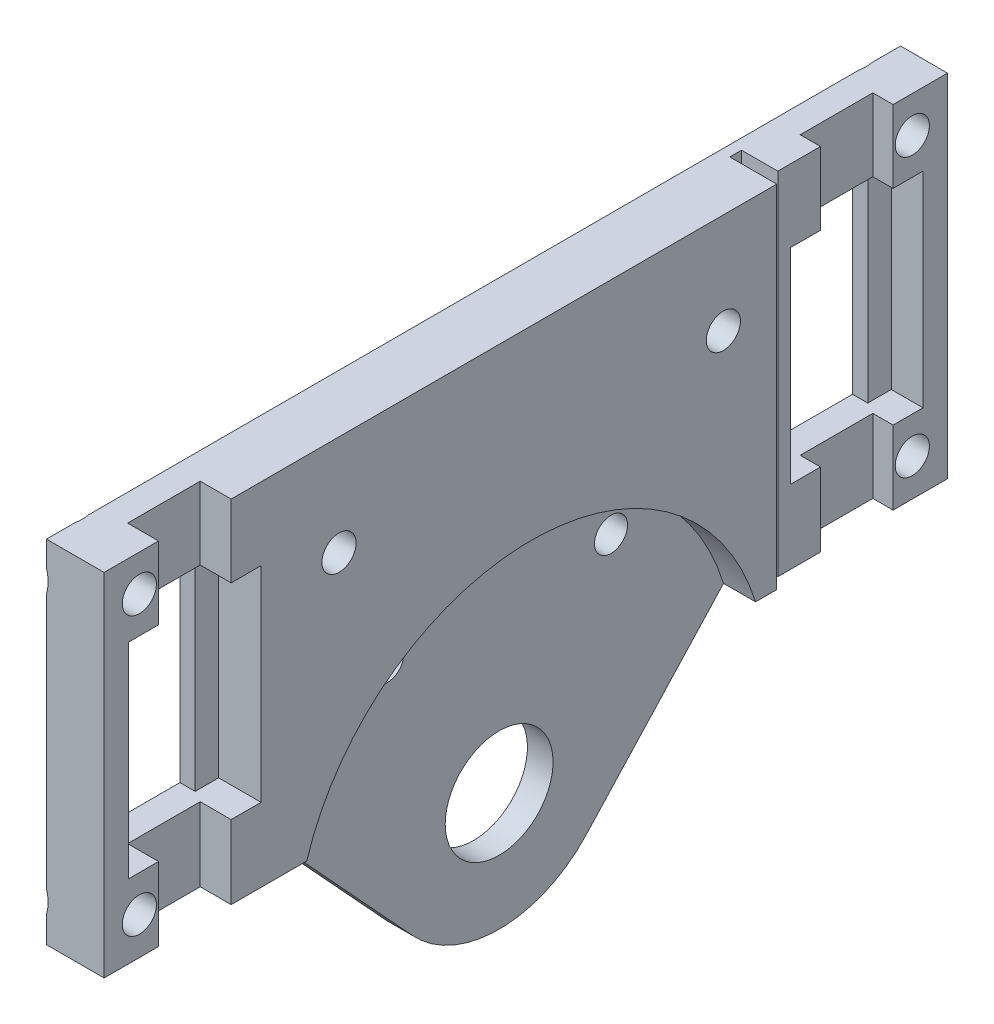
from build123d import *

# Parameters (mm, degrees)
ESQUISSE2_W                                       = 80
ESQUISSE2_H                                       = 85
PLAQUE_DEPTH                                      = 5.4
ESQUISSE15_R                                      = 22
D_GAGEMENT_ROUE_DEPTH                             = 81.678373806
D_COUPE_INF_RIEURE_DEPTH                          = 81.803217758
ESQUISSE14_R                                      = 11.05
ESQUISSE14_R_2                                    = 5.05
RENFORT_ROULEMENT_DEPTH                           = 2.4
D_COUPE_SUP_RIEURE_DEPTH                          = 81.803217758
D_GAGEMENT_AXE_6_DEPTH                            = 75.400336021
D_GAGEMENT_AXE_6_DEPTH_BACK                       = 75.400336021
ESQUISSE26_W                                      = 6.8
ESQUISSE26_H                                      = 6.8
D_GAGEMENT_START                                  = 1.4
D_GAGEMENT_DOUILLE_DEPTH                          = 19.2
R_P_TITION_LIN_AIRE1_COUNT                        = 2
R_P_TITION_LIN_AIRE1_PITCH                        = 26
MORS_D_FORMABLE_DOUILLE_DEPTH                     = 75.400336021
MORS_D_FORMABLE_DOUILLE_DEPTH_BACK                = 75.400336021
FRAISAGE_POUR_VIS_T_TE_FRAIS_E_BOMB_E_D           = 3.2
FRAISAGE_POUR_VIS_T_TE_FRAIS_E_BOMB_E_CSINK_D     = 6.92
FRAISAGE_POUR_VIS_T_TE_FRAIS_E_BOMB_E_CSINK_ANGLE = 90
ESQUISSE31_W                                      = 80
ESQUISSE31_H                                      = 35.1
ENL_V_MAT_EXTRU_1_DEPTH                           = 5.4
BOSS_EXTRU_1_DEPTH                                = 2.4
ESQUISSE34_R                                      = 1.55
ENL_V_MAT_EXTRU_2_DEPTH                           = 10


with BuildPart() as part:
    # Esquisse2 → plaque (new body)
    with BuildSketch(Plane(origin=(0, 0, 0), x_dir=(0, 0, -1), z_dir=(1, 0, 0))):
        with Locations((0, 27.5)):
            Rectangle(ESQUISSE2_W, ESQUISSE2_H)
    extrude(amount=PLAQUE_DEPTH)

    # Esquisse15 → dégagement roue (cut, through all)
    with BuildSketch(Plane.ZY.offset(-2.4)):
        with Locations((0, -12)):
            Circle(ESQUISSE15_R)
    extrude(amount=-D_GAGEMENT_ROUE_DEPTH, mode=Mode.SUBTRACT)

    # Esquisse18 → découpe_inférieure (cut, through all)
    with BuildSketch(Plane(origin=(0, 0, 0), x_dir=(0, 0, -1), z_dir=(1, 0, 0))):
        Polygon((-7.446869682, -5.5), (-40, -5.5), (-40, -15), (40, -15), (40, -5.5), (7.446869682, -5.5), align=None)
    extrude(amount=D_COUPE_INF_RIEURE_DEPTH, mode=Mode.SUBTRACT)

    # Esquisse14 → renfort_roulement (add)
    with BuildSketch(Plane(origin=(0, 0, 0), x_dir=(0, 0, -1), z_dir=(1, 0, 0))):
        with Locations((0, -12)):
            Circle(ESQUISSE14_R)
        with Locations((0, -12)):
            Circle(ESQUISSE14_R_2, mode=Mode.SUBTRACT)
    extrude(amount=RENFORT_ROULEMENT_DEPTH)

    # Esquisse20 → découpe_supérieure (cut, through all)
    with BuildSketch(Plane(origin=(0, 0, 0), x_dir=(0, 0, -1), z_dir=(1, 0, 0))):
        with BuildLine():
            Line((-40, 70), (40, 70))
            Line((40, 70), (40, 62.5))
            Line((40, 62.5), (26, 62.5))
            ThreePointArc((26, 62.5), (22.956192855, 61.466766701), (21.170370869, 58.794095226))
            Line((21.170370869, 58.794095226), (15.559208556, 37.852952387))
            ThreePointArc((15.559208556, 37.852952387), (14.666297563, 36.516616649), (13.144393991, 36))
            Line((13.144393991, 36), (-13.144393991, 36))
            ThreePointArc((-13.144393991, 36), (-14.666297563, 36.516616649), (-15.559208556, 37.852952387))
            Line((-15.559208556, 37.852952387), (-21.170370869, 58.794095226))
            ThreePointArc((-21.170370869, 58.794095226), (-22.956192855, 61.466766701), (-26, 62.5))
            Line((-26, 62.5), (-40, 62.5))
            Line((-40, 62.5), (-40, 70))
        make_face()
    extrude(amount=D_COUPE_SUP_RIEURE_DEPTH, mode=Mode.SUBTRACT)

    # Esquisse26 → dégagement axe 6 (cut, two sides: drawn at the far end of the back side and taken through both)
    with BuildSketch(Plane(origin=(0, 0, 0), x_dir=(1, 0, 0), z_dir=(0, 1, 0)).offset(-D_GAGEMENT_AXE_6_DEPTH_BACK)):
        with Locations((5.9, 31.5)):
            Rectangle(ESQUISSE26_W, ESQUISSE26_H)
        with Locations((5.9, -31.5)):
            Rectangle(ESQUISSE26_W, ESQUISSE26_H)
    extrude(amount=D_GAGEMENT_AXE_6_DEPTH + D_GAGEMENT_AXE_6_DEPTH_BACK, mode=Mode.SUBTRACT)

    # Esquisse28 → dégagement douille (cut)
    with BuildSketch(Plane(origin=(0, 0, 0), x_dir=(1, 0, 0), z_dir=(0, 1, 0)).offset(D_GAGEMENT_START)):
        Polygon((0, 35.5), (1.427864045, 35.5), (1.427864045, 37.7), (10.372135955, 37.7), (10.372135955, 25.3), (1.427864045, 25.3), (1.427864045, 27.5), (0, 27.5), align=None)
        Polygon((10.372135955, -25.3), (1.427864045, -25.3), (1.427864045, -27.5), (0, -27.5), (0, -35.5), (1.427864045, -35.5), (1.427864045, -37.7), (10.372135955, -37.7), align=None)
    d_gagement_douille = extrude(amount=D_GAGEMENT_DOUILLE_DEPTH, mode=Mode.SUBTRACT)

    # Répétition linéaire1: dégagement douille ×2
    with Locations(*[(0, i * R_P_TITION_LIN_AIRE1_PITCH, 0) for i in range(1, R_P_TITION_LIN_AIRE1_COUNT)]):
        add(d_gagement_douille, mode=Mode.SUBTRACT)

    # Esquisse19 → Mors_déformable_douille (cut, two sides: drawn at the far end of the back side and taken through both)
    with BuildSketch(Plane(origin=(0, 0, 0), x_dir=(1, 0, 0), z_dir=(0, 1, 0)).offset(-MORS_D_FORMABLE_DOUILLE_DEPTH_BACK)):
        Polygon((5.4, 40), (4.4, 40), (4.4, 24.1), (1, 24.1), (1, 23), (5.4, 23), align=None)
    extrude(amount=MORS_D_FORMABLE_DOUILLE_DEPTH + MORS_D_FORMABLE_DOUILLE_DEPTH_BACK, mode=Mode.SUBTRACT)

    # Fraisage pour vis à tête fraisée bombée fendue M31 (through all)
    with Locations(Plane.ZY):
        with Locations((18, 18), (36.7, 24), (36.7, -2), (21, 34)):
            fraisage_pour_vis_t_te_frais_e_bomb_e = CounterSinkHole(FRAISAGE_POUR_VIS_T_TE_FRAIS_E_BOMB_E_D / 2, FRAISAGE_POUR_VIS_T_TE_FRAIS_E_BOMB_E_CSINK_D / 2, counter_sink_angle=FRAISAGE_POUR_VIS_T_TE_FRAIS_E_BOMB_E_CSINK_ANGLE)

    # Esquisse31 → Enlèv. mat.-Extru.1 (cut)
    with BuildSketch(Plane(origin=(5.4, 0, 0), x_dir=(0, 0, -1), z_dir=(1, 0, 0))):
        with Locations((0, 44.95)):
            Rectangle(ESQUISSE31_W, ESQUISSE31_H)
    extrude(amount=-ENL_V_MAT_EXTRU_1_DEPTH, mode=Mode.SUBTRACT)

    # Esquisse33 → Boss.-Extru.1 (add)
    with BuildSketch(Plane(origin=(2.4, 0, 0), x_dir=(0, 0, -1), z_dir=(1, 0, 0))):
        Polygon((-8.125418007, -19.488663579), (-21.017849557, -5.5), (-8.936022605, -5.5), align=None)
        Polygon((8.125418007, -19.488663579), (21.017849557, -5.5), (8.936022605, -5.5), align=None)
    extrude(amount=-BOSS_EXTRU_1_DEPTH)

    # Symétrie4: Fraisage pour vis à tête fraisée bombée fendue M31 across plane
    add(fraisage_pour_vis_t_te_frais_e_bomb_e.mirror(Plane.XY), mode=Mode.SUBTRACT)

    # Esquisse34 → Enlèv. mat.-Extru.2 (cut)
    with BuildSketch(Plane(origin=(2.4, 0, 0), x_dir=(0, 0, -1), z_dir=(1, 0, 0))):
        with Locations((-10.48, 3.75)):
            Circle(ESQUISSE34_R)
        with Locations((10.48, 3.75)):
            Circle(ESQUISSE34_R)
    extrude(amount=-ENL_V_MAT_EXTRU_2_DEPTH, mode=Mode.SUBTRACT)


solid = part.part
